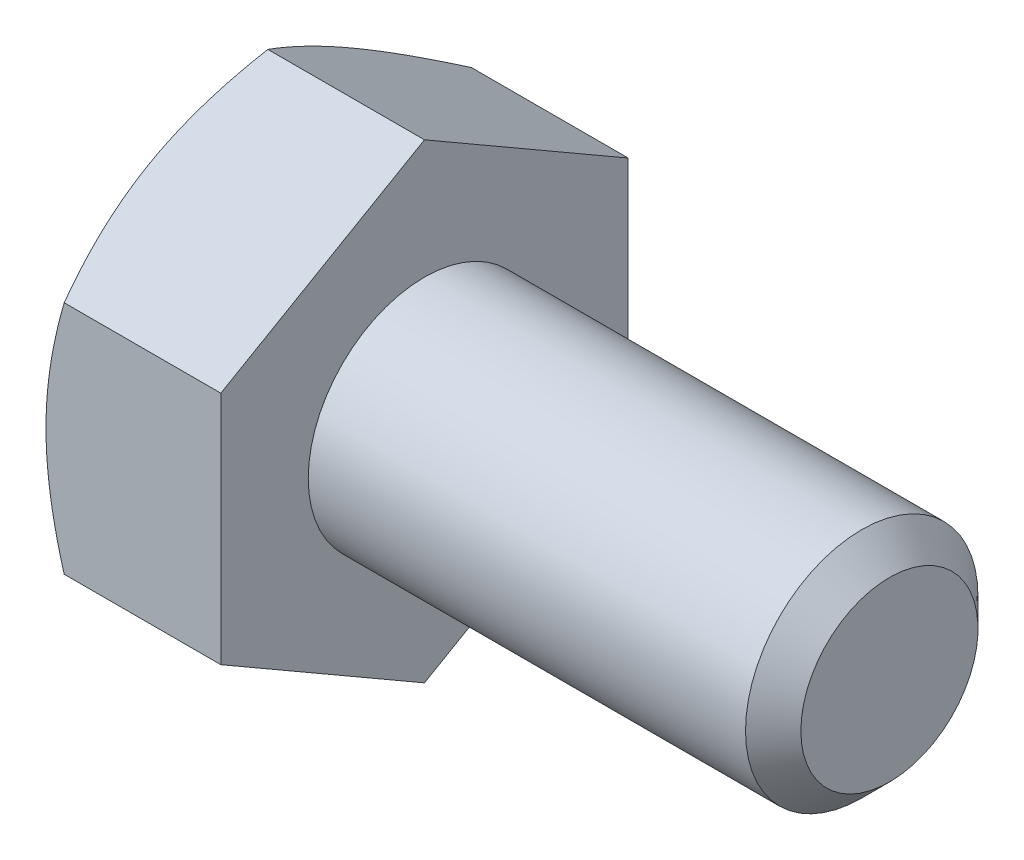
from build123d import *

# Parameters (mm, degrees)
BASEHEAD_DEPTH = 4.7752


with BuildPart() as part:
    # Sketch1 → BaseHead (new body)
    with BuildSketch(Plane(origin=(0, 0, 0), x_dir=(0, 0, -1), z_dir=(1, 0, 0))):
        Polygon((5.5626, 3.211568607), (5.5626, -3.211568607), (0, -6.423137215), (-5.5626, -3.211568607), (-5.5626, 3.211568607), (0, 6.423137215), align=None)
    extrude(amount=BASEHEAD_DEPTH)

    # BodySke → BaseBody (revolve)
    with BuildSketch(Plane.XY, mode=Mode.PRIVATE) as basebody_sk:
        Polygon((0, 0), (17.4752, 0), (17.4752, 2.41935), (16.71955, 3.175), (0, 3.175), align=None)
    revolve(basebody_sk.sketch.rotate(Axis((0, 0, 0), (1, 0, 0)), 90), axis=Axis((0, 0, 0), (1, 0, 0)))

    # Sketch3 → HeadChamfer (revolve, cut)
    with BuildSketch(Plane.XY):
        Polygon((0, 5.5626), (4.163005602, 12.773137215), (4.163005602, 19.123137215), (-12.7, 19.123137215), (-12.7, 5.5626), align=None)
    revolve(axis=Axis((0, 0, 0), (1, 0, 0)), mode=Mode.SUBTRACT)


solid = part.part
